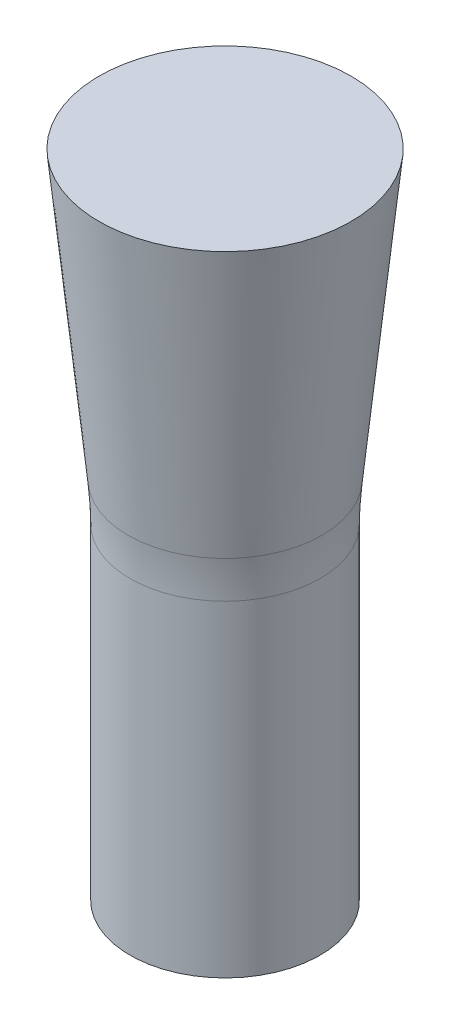
from build123d import *


with BuildPart() as part:
    # Sketch4 → Revolve1 (revolve)
    with BuildSketch(Plane.XY, mode=Mode.PRIVATE) as revolve1_sk:
        with BuildLine():
            Line((0, 0), (0, 12.05))
            Line((0, 12.05), (0, 17.05))
            Line((0, 17.05), (3.3, 17.05))
            Line((3.3, 17.05), (2.540867045, 9.552390567))
            ThreePointArc((2.540867045, 9.552390567), (2.502724857, 9.049357447), (2.49, 8.545040855))
            Line((2.49, 8.545040855), (2.49, 0))
            Line((2.49, 0), (0, 0))
        make_face()
    revolve(revolve1_sk.sketch.rotate(Axis((0, 0, 0), (0, 1, 0)), 90), axis=Axis((0, 0, 0), (0, 1, 0)))


solid = part.part
